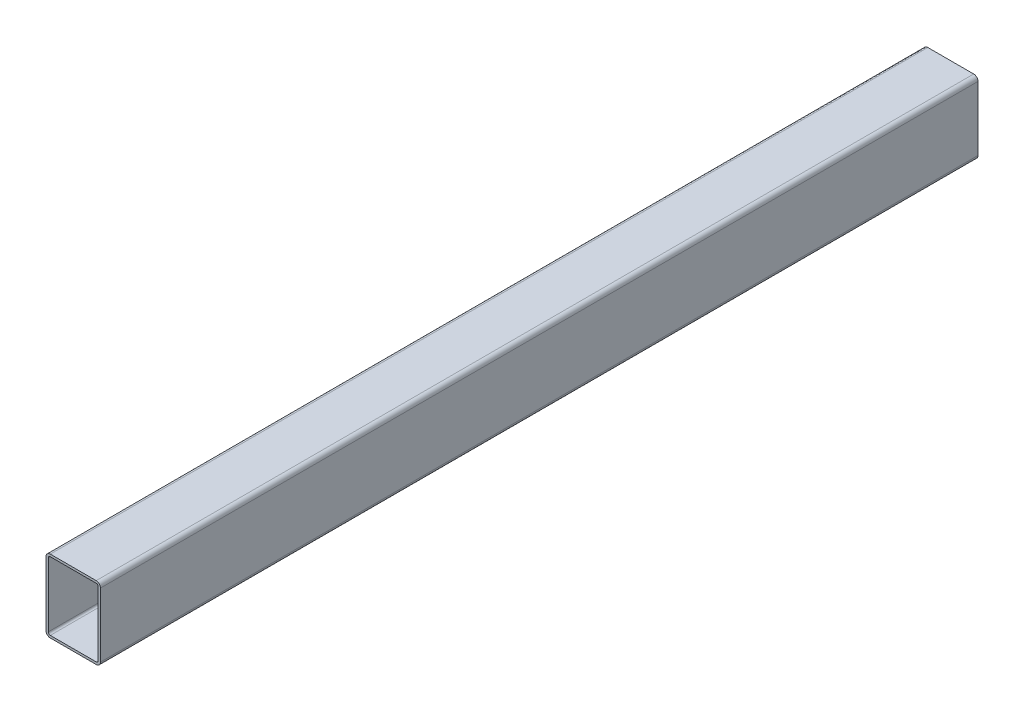
from build123d import *

# Parameters (mm, degrees)
BOSS_EXTRUDE1_DEPTH = 613.5


with BuildPart() as part:
    # Sketch1 → Boss-Extrude1 (new, symmetric)
    with BuildSketch(Plane.XY):
        with BuildLine():
            Line((32.1, -50.8), (-32.1, -50.8))
            ThreePointArc((-32.1, -50.8), (-36.342640687, -49.042640687), (-38.1, -44.8))
            Line((-38.1, -44.8), (-38.1, 44.8))
            ThreePointArc((-38.1, 44.8), (-36.342640687, 49.042640687), (-32.1, 50.8))
            Line((-32.1, 50.8), (32.1, 50.8))
            ThreePointArc((32.1, 50.8), (36.342640687, 49.042640687), (38.1, 44.8))
            Line((38.1, 44.8), (38.1, -44.8))
            ThreePointArc((38.1, -44.8), (36.342640687, -49.042640687), (32.1, -50.8))
        make_face()
        with BuildLine():
            Line((32.1, 47.625), (-32.1, 47.625))
            ThreePointArc((-32.1, 47.625), (-34.097576657, 46.797576657), (-34.925, 44.8))
            Line((-34.925, 44.8), (-34.925, -44.8))
            ThreePointArc((-34.925, -44.8), (-34.097576657, -46.797576657), (-32.1, -47.625))
            Line((-32.1, -47.625), (32.1, -47.625))
            ThreePointArc((32.1, -47.625), (34.097576657, -46.797576657), (34.925, -44.8))
            Line((34.925, -44.8), (34.925, 44.8))
            ThreePointArc((34.925, 44.8), (34.097576657, 46.797576657), (32.1, 47.625))
        make_face(mode=Mode.SUBTRACT)
    extrude(amount=BOSS_EXTRUDE1_DEPTH, both=True)


solid = part.part
